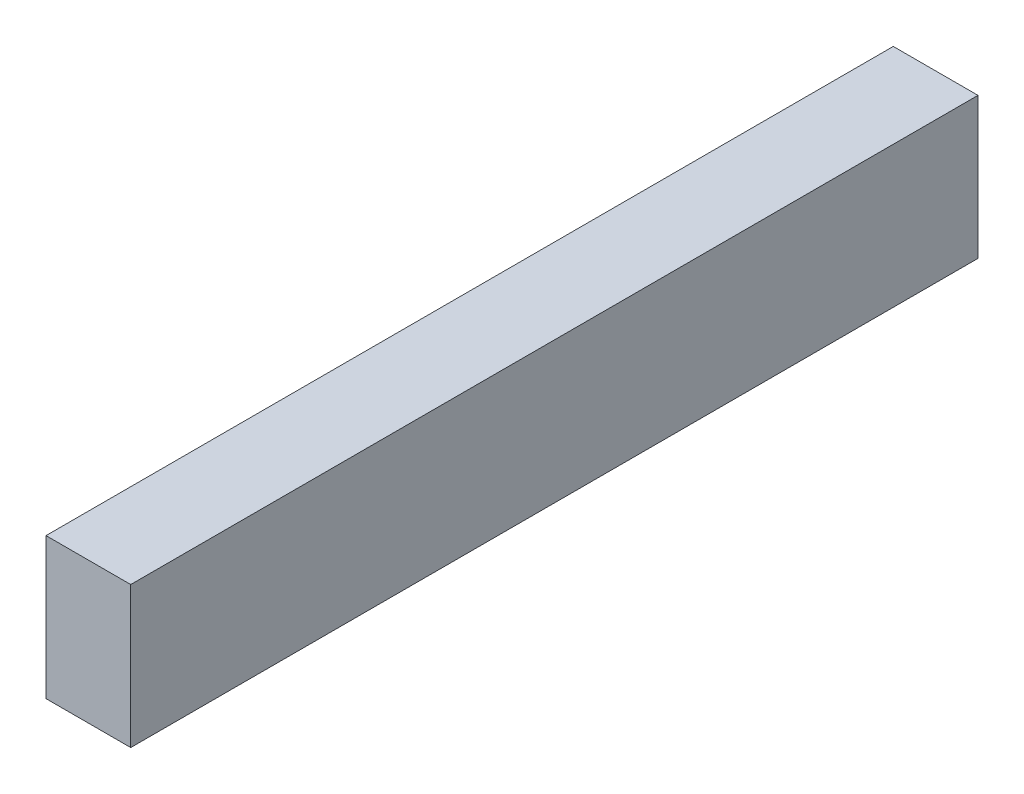
from build123d import *

# Parameters (mm, degrees)
SKETCH_1_W      = 30
SKETCH_1_H      = 50
EXTRUDE_1_DEPTH = 300


with BuildPart() as part:
    # 草图1 → 凸台-拉伸1 (new body)
    with BuildSketch(Plane.XY):
        Rectangle(SKETCH_1_W, SKETCH_1_H)
    extrude(amount=EXTRUDE_1_DEPTH)


solid = part.part
